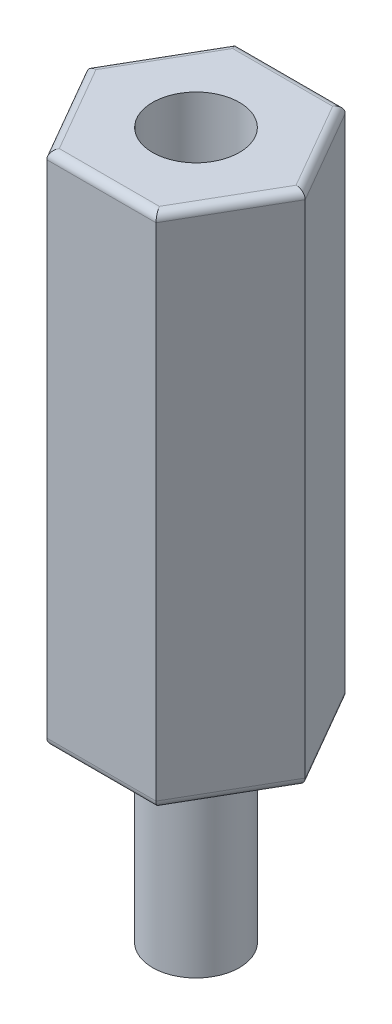
from build123d import *

# Parameters (mm, degrees)
RESSALTO_EXTRUS_O1_DEPTH = 13
FILETE1_R                = 0.2
ESBO_O2_R                = 1.0922
RESSALTO_EXTRUS_O2_DEPTH = 4.76
ESBO_O3_R                = 1.0922
CORTE_EXTRUS_O1_DEPTH    = 4.76


with BuildPart() as part:
    # Esboço1 → Ressalto-extrusão1 (new body)
    with BuildSketch(Plane(origin=(0, 0, 0), x_dir=(1, 0, 0), z_dir=(0, 1, 0))):
        Polygon((2.748187281, 0), (1.374093641, 2.38), (-1.374093641, 2.38), (-2.748187281, 0), (-1.374093641, -2.38), (1.374093641, -2.38), align=None)
    extrude(amount=RESSALTO_EXTRUS_O1_DEPTH)

    # Filete1
    filete1_edges = [part.edges().sort_by_distance(p)[0] for p in [
        (0, 13, -2.38),
        (-2.061140461, 13, -1.19),
        (-2.061140461, 13, 1.19),
        (0, 13, 2.38),
        (2.061140461, 13, 1.19),
        (0, 0, 2.38),
        (-2.061140461, 0, 1.19),
        (-2.061140461, 0, -1.19),
        (2.061140461, 13, -1.19),
        (0, 0, -2.38),
        (2.061140461, 0, -1.19),
        (2.061140461, 0, 1.19),
    ]]
    fillet(filete1_edges, radius=FILETE1_R)

    # Esboço2 → Ressalto-extrusão2 (add)
    with BuildSketch(Plane.XZ):
        with Locations(Location((0, 0, 0), (0, 0, 90))):
            Circle(ESBO_O2_R)
    extrude(amount=RESSALTO_EXTRUS_O2_DEPTH)

    # Esboço3 → Corte-extrusão1 (cut)
    with BuildSketch(Plane(origin=(0, 13, 0), x_dir=(1, 0, 0), z_dir=(0, 1, 0))):
        with Locations(Location((0, 0, 0), (0, 0, 270))):
            Circle(ESBO_O3_R)
    extrude(amount=-CORTE_EXTRUS_O1_DEPTH, mode=Mode.SUBTRACT)


solid = part.part
